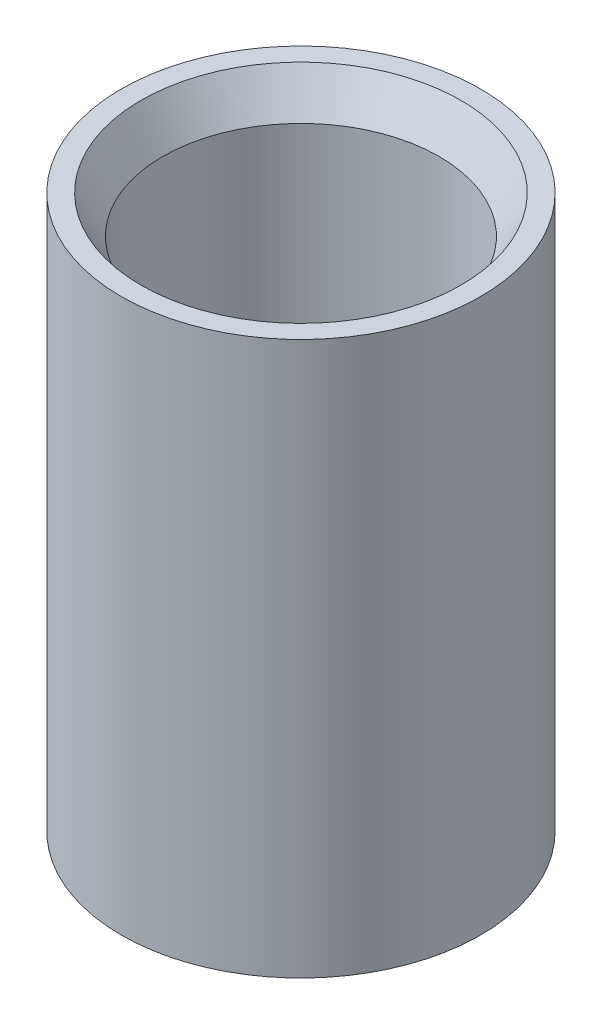
from build123d import *

# Parameters (mm, degrees)
SKETCH1_R           = 16.51
SKETCH1_R_2         = 12.7
BOSS_EXTRUDE1_DEPTH = 50.8
CHAMFER1_SIZE       = 2
CHAMFER1_SIZE2      = 3.464101615


with BuildPart() as part:
    # Sketch1 → Boss-Extrude1 (new body)
    with BuildSketch(Plane(origin=(0, 0, 0), x_dir=(1, 0, 0), z_dir=(0, 1, 0))):
        with Locations(Location((0, 0, 0), (0, 0, 270))):
            Circle(SKETCH1_R)
        with Locations(Location((0, 0, 0), (0, 0, 270))):
            Circle(SKETCH1_R_2, mode=Mode.SUBTRACT)
    extrude(amount=BOSS_EXTRUDE1_DEPTH)

    # Chamfer1
    chamfer1_edges = [part.edges().sort_by_distance(p)[0] for p in [
        (0, 50.8, -12.7),
    ]]
    chamfer1_side = [part.faces().sort_by_distance(p)[0] for p in [
        (0, 50.8, -16.043026682),
    ]]
    chamfer(chamfer1_edges, length=CHAMFER1_SIZE, length2=CHAMFER1_SIZE2, reference=chamfer1_side[0])


solid = part.part
